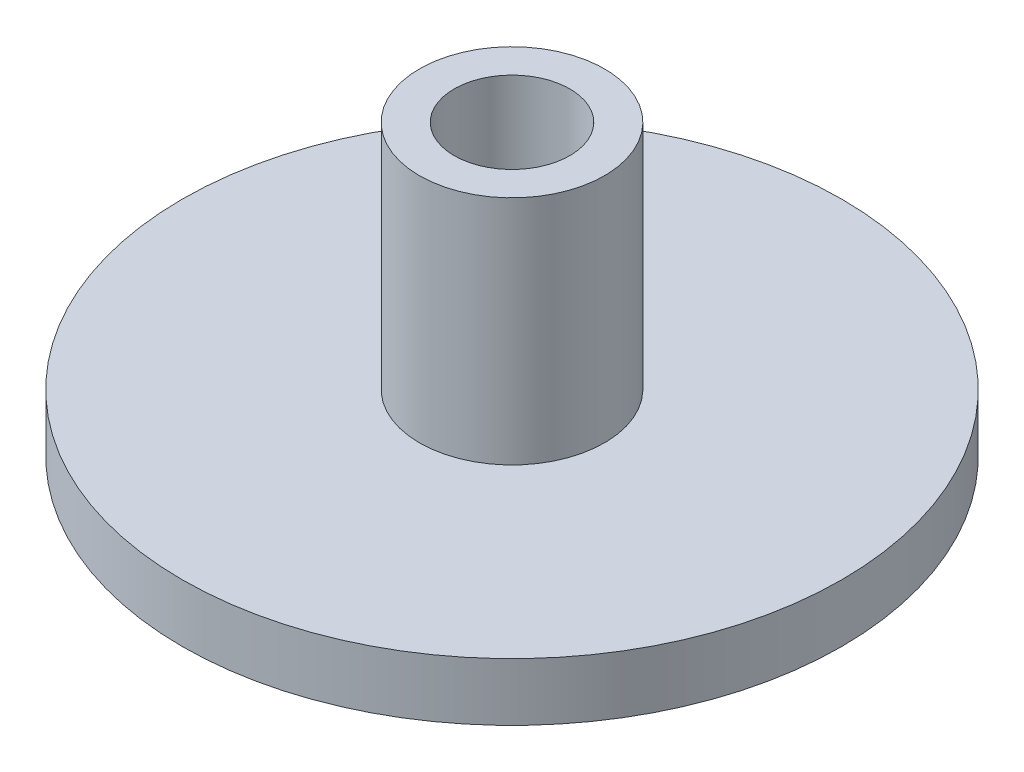
from build123d import *

# Parameters (mm, degrees)
SKETCH1_R           = 28.5
BOSS_EXTRUDE1_DEPTH = 5
SKETCH2_R           = 8
BOSS_EXTRUDE2_DEPTH = 20
SKETCH3_R           = 5
CUT_EXTRUDE1_DEPTH  = 48.428894147


with BuildPart() as part:
    # Sketch1 → Boss-Extrude1 (new body)
    with BuildSketch(Plane(origin=(0, 0, 0), x_dir=(1, 0, 0), z_dir=(0, 1, 0))):
        with Locations(Location((0, 0, 0), (0, 0, 270))):
            Circle(SKETCH1_R)
    extrude(amount=BOSS_EXTRUDE1_DEPTH)

    # Sketch2 → Boss-Extrude2 (add)
    with BuildSketch(Plane(origin=(0, 5, 0), x_dir=(1, 0, 0), z_dir=(0, 1, 0))):
        with Locations(Location((0, 0, 0), (0, 0, 270))):
            Circle(SKETCH2_R)
    extrude(amount=BOSS_EXTRUDE2_DEPTH)

    # Sketch3 → Cut-Extrude1 (cut, through all)
    with BuildSketch(Plane(origin=(0, 25, 0), x_dir=(1, 0, 0), z_dir=(0, 1, 0))):
        with Locations(Location((0, 0, 0), (0, 0, 270))):
            Circle(SKETCH3_R)
    extrude(amount=-CUT_EXTRUDE1_DEPTH, mode=Mode.SUBTRACT)


solid = part.part
